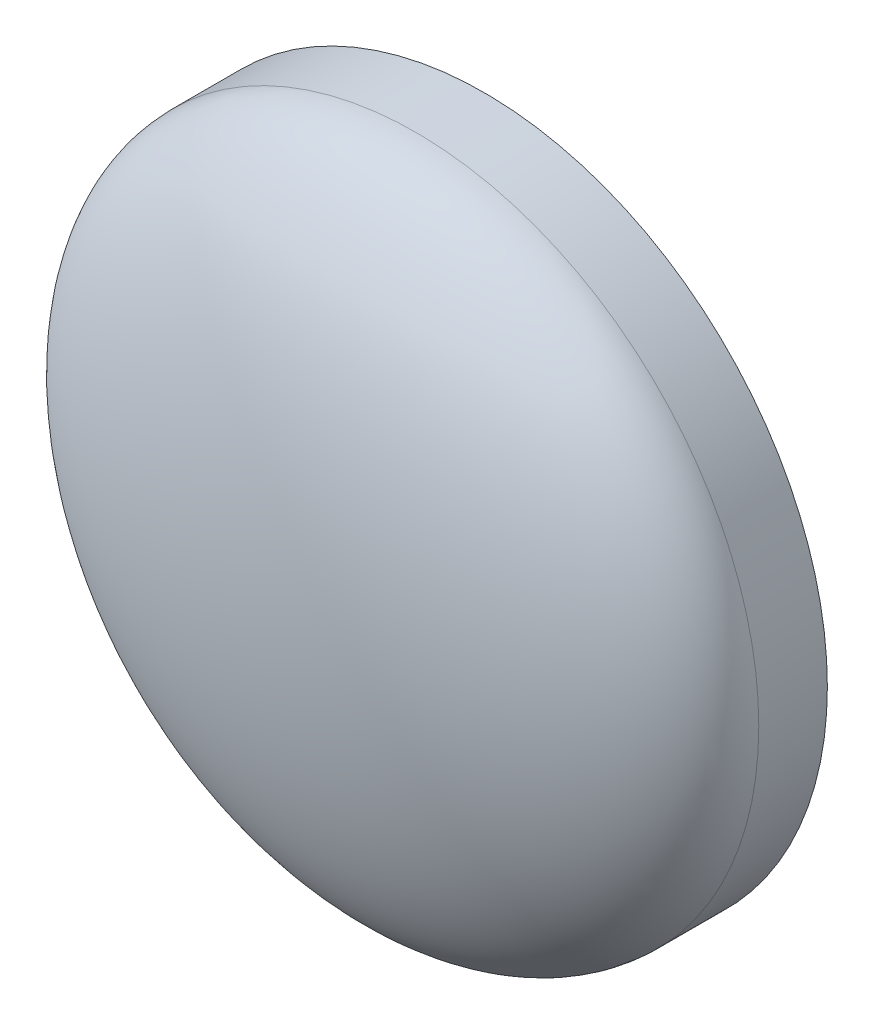
from build123d import *

# Parameters (mm, degrees)
ESQUISSE1_R             = 25
BOSS_EXTRU_1_DEPTH      = 5
ENL_V_MAT_EXTRU_1_DEPTH = 3
D_ME1_FACE_RADIUS       = 25
D_ME1_HEIGHT            = 10


with BuildPart() as part:
    # Esquisse1 → Boss.-Extru.1 (new body)
    with BuildSketch(Plane.XY):
        Circle(ESQUISSE1_R)
    extrude(amount=BOSS_EXTRU_1_DEPTH)

    # Esquisse1<7> → Enlèv. mat.-Extru.1 (cut)
    with BuildSketch(Plane.XY):
        with BuildLine():
            Line((13.926414777, -3.806711623), (12.973693151, -3.372870175))
            ThreePointArc((12.973693151, -3.372870175), (12.733506213, -3.141062984), (12.692724073, -2.809760772))
            ThreePointArc((12.692724073, -2.809760772), (-11.829492988, 5.391019908), (10.447719463, -7.735965229))
            ThreePointArc((10.447719463, -7.735965229), (10.724383559, -7.549423688), (11.056794316, -7.57847291))
            Line((11.056794316, -7.57847291), (12.009590144, -8.012416083))
            ThreePointArc((12.009590144, -8.012416083), (12.285475329, -8.338641219), (12.208610947, -8.758911776))
            ThreePointArc((12.208610947, -8.758911776), (-13.672833437, 6.230757786), (14.62013485, -3.467041062))
            ThreePointArc((14.62013485, -3.467041062), (14.353503323, -3.8007296), (13.926414777, -3.806711623))
        make_face()
    extrude(amount=ENL_V_MAT_EXTRU_1_DEPTH, mode=Mode.SUBTRACT)

    # Dôme1: an elliptical dome of height H over a round flat face of radius A is half a spheroid: the quarter ellipse of half axes A and H revolved about the face's axis
    with BuildSketch(Plane((0, 0, 5), x_dir=(0, 1, 0), z_dir=(1, 0, 0)), mode=Mode.PRIVATE) as d_me1_quarter:
        Ellipse(D_ME1_FACE_RADIUS, D_ME1_HEIGHT)
        Rectangle(D_ME1_FACE_RADIUS, D_ME1_HEIGHT, align=(Align.MIN, Align.MIN), mode=Mode.INTERSECT)
    revolve(d_me1_quarter.sketch, axis=Axis((0, 0, 5), (0, 0, 1)))


solid = part.part
